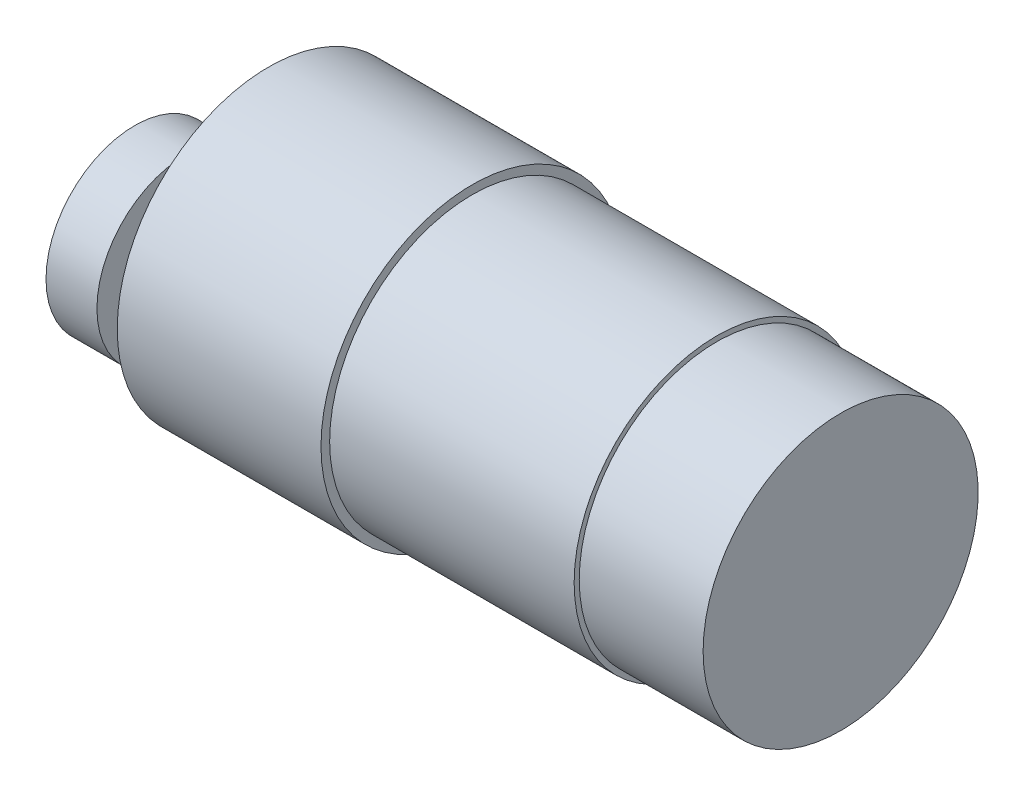
from build123d import *

# Parameters (mm, degrees)
ESQUISSE6_R                                   = 18.8595
BOSS_EXTRU_2_DEPTH                            = 25.4
ESQUISSE7_R                                   = 17.78
BOSS_EXTRU_3_DEPTH                            = 30.48
ESQUISSE8_R                                   = 17.145
BOSS_EXTRU_4_DEPTH                            = 15.4432
ESQUISSE9_R                                   = 5.969
BOSS_EXTRU_5_DEPTH                            = 6.096
ESQUISSE10_R                                  = 4.699
BOSS_EXTRU_6_DEPTH                            = 4.233333333
ESQUISSE11_R                                  = 11.0617
BOSS_EXTRU_7_DEPTH                            = 6.35
ESQUISSE12_R                                  = 4.7752
BOSS_EXTRU_8_DEPTH                            = 3.302
PER_AGE_POUR_TUYAU_POUR_TROU_TARAUD_1_1_D     = 6.1468
PER_AGE_POUR_TUYAU_POUR_TROU_TARAUD_1_1_DEPTH = 19.981333333
BOSS_EXTRU_9_DEPTH                            = 19.981333333
BOSS_EXTRU_10_DEPTH                           = 2.032
ENL_V_MAT_EXTRU_2_REACH                       = 93.955
ESQUISSE18_R                                  = 1.4605
ESQUISSE19_R                                  = 1.5
ESQUISSE19_R_2                                = 1.500000048
ENL_V_MAT_EXTRU_3_DEPTH                       = 5


with BuildPart() as part:
    # Esquisse6 → Boss.-Extru.2 (new body)
    with BuildSketch(Plane(origin=(0, 0, 0), x_dir=(0, 0, -1), z_dir=(1, 0, 0))):
        Circle(ESQUISSE6_R)
    extrude(amount=BOSS_EXTRU_2_DEPTH)

    # Esquisse7 → Boss.-Extru.3 (add)
    with BuildSketch(Plane(origin=(25.4, 0, 0), x_dir=(0, 0, -1), z_dir=(1, 0, 0))):
        with Locations(Location((0, 0, 0), (0, 0, 180))):
            Circle(ESQUISSE7_R)
    extrude(amount=BOSS_EXTRU_3_DEPTH)

    # Esquisse8 → Boss.-Extru.4 (add)
    with BuildSketch(Plane(origin=(55.88, 0, 0), x_dir=(0, 0, -1), z_dir=(1, 0, 0))):
        with Locations(Location((0, 0, 0), (0, 0, 180))):
            Circle(ESQUISSE8_R)
    extrude(amount=BOSS_EXTRU_4_DEPTH)

    # Esquisse9 → Boss.-Extru.5 (add)
    with BuildSketch(Plane.ZY):
        with Locations(Location((0, -6.858, 0), (0, 0, 180))):
            Circle(ESQUISSE9_R)
    extrude(amount=BOSS_EXTRU_5_DEPTH)

    # Esquisse10 → Boss.-Extru.6 (add)
    with BuildSketch(Plane.ZY.offset(6.096)):
        with Locations((0, -6.858)):
            Circle(ESQUISSE10_R)
    extrude(amount=BOSS_EXTRU_6_DEPTH)

    # Esquisse11 → Boss.-Extru.7 (add)
    with BuildSketch(Plane.ZY.offset(10.329333333)):
        with Locations((0, -6.858)):
            Circle(ESQUISSE11_R)
    extrude(amount=BOSS_EXTRU_7_DEPTH)

    # Esquisse12 → Boss.-Extru.8 (add)
    with BuildSketch(Plane.ZY.offset(16.679333333)):
        with Locations(Location((0, -6.858, 0), (0, 0, 180))):
            Circle(ESQUISSE12_R)
    extrude(amount=BOSS_EXTRU_8_DEPTH)

    # Perçage pour tuyau pour trou taraudé 1/161
    with Locations(Plane.ZY.offset(19.981333333)):
        with Locations((0, -6.858)):
            Hole(PER_AGE_POUR_TUYAU_POUR_TROU_TARAUD_1_1_D / 2, depth=PER_AGE_POUR_TUYAU_POUR_TROU_TARAUD_1_1_DEPTH)

    # Esquisse16 → Boss.-Extru.9 (add)
    with BuildSketch(Plane.ZY):
        with BuildLine():
            Line((-1.778, -4.476758467), (1.778, -4.476758467))
            ThreePointArc((1.778, -4.476758467), (0, -9.8298), (-1.778, -4.476758467))
        make_face()
    extrude(amount=BOSS_EXTRU_9_DEPTH)

    # Esquisse17 → Boss.-Extru.10 (add)
    with BuildSketch(Plane.ZY.offset(19.981333333)):
        with BuildLine():
            Line((-1.778, -4.476758467), (1.778, -4.476758467))
            ThreePointArc((1.778, -4.476758467), (0, -9.8298), (-1.778, -4.476758467))
        make_face()
    extrude(amount=BOSS_EXTRU_10_DEPTH)

    # Esquisse18 → Enlèv. mat.-Extru.2 (cut, up to next)
    with BuildSketch(Plane.ZY.offset(16.679333333), mode=Mode.PRIVATE) as enl_v_mat_extru_2_sk1:
        with Locations((0, -0.254)):
            Circle(ESQUISSE18_R)
    enl_v_mat_extru_2_tool1 = extrude(enl_v_mat_extru_2_sk1.sketch, amount=-ENL_V_MAT_EXTRU_2_REACH, mode=Mode.PRIVATE) & part.part
    # Esquisse18 → Enlèv. mat.-Extru.2 (cut, up to next)
    with BuildSketch(Plane.ZY.offset(16.679333333), mode=Mode.PRIVATE) as enl_v_mat_extru_2_sk2:
        with Locations((6.604, -6.858)):
            Circle(ESQUISSE18_R)
    enl_v_mat_extru_2_tool2 = extrude(enl_v_mat_extru_2_sk2.sketch, amount=-ENL_V_MAT_EXTRU_2_REACH, mode=Mode.PRIVATE) & part.part
    # Esquisse18 → Enlèv. mat.-Extru.2 (cut, up to next)
    with BuildSketch(Plane.ZY.offset(16.679333333), mode=Mode.PRIVATE) as enl_v_mat_extru_2_sk3:
        with Locations((0, -13.462)):
            Circle(ESQUISSE18_R)
    enl_v_mat_extru_2_tool3 = extrude(enl_v_mat_extru_2_sk3.sketch, amount=-ENL_V_MAT_EXTRU_2_REACH, mode=Mode.PRIVATE) & part.part
    # Esquisse18 → Enlèv. mat.-Extru.2 (cut, up to next)
    with BuildSketch(Plane.ZY.offset(16.679333333), mode=Mode.PRIVATE) as enl_v_mat_extru_2_sk4:
        with Locations((-6.604, -6.858)):
            Circle(ESQUISSE18_R)
    enl_v_mat_extru_2_tool4 = extrude(enl_v_mat_extru_2_sk4.sketch, amount=-ENL_V_MAT_EXTRU_2_REACH, mode=Mode.PRIVATE) & part.part
    add(enl_v_mat_extru_2_tool1.solids().sort_by_distance((-16.679333, -0.254, 0))[0], mode=Mode.SUBTRACT)
    add(enl_v_mat_extru_2_tool2.solids().sort_by_distance((-16.679333, -6.858, 6.604))[0], mode=Mode.SUBTRACT)
    add(enl_v_mat_extru_2_tool3.solids().sort_by_distance((-16.679333, -13.462, 0))[0], mode=Mode.SUBTRACT)
    add(enl_v_mat_extru_2_tool4.solids().sort_by_distance((-16.679333, -6.858, -6.604))[0], mode=Mode.SUBTRACT)

    # Esquisse19 → Enlèv. mat.-Extru.3 (cut)
    with BuildSketch(Plane.ZY):
        with Locations((7.290871183, 15.311440527)):
            Circle(ESQUISSE19_R)
        with Locations((7.253318208, -15.510626024)):
            Circle(ESQUISSE19_R_2)
        with Locations((-16.809397398, 1.555003695)):
            Circle(ESQUISSE19_R_2)
    extrude(amount=-ENL_V_MAT_EXTRU_3_DEPTH, mode=Mode.SUBTRACT)


solid = part.part
